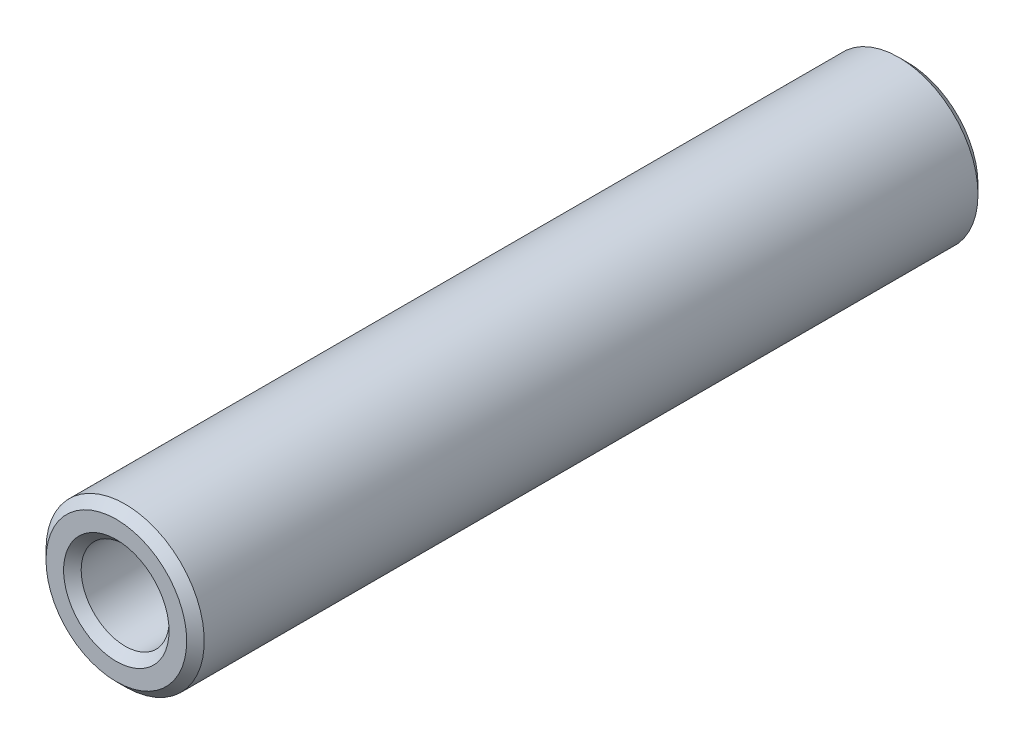
from build123d import *

# Parameters (mm, degrees)
SKETCH1_R           = 4.5
SKETCH1_R_2         = 2.5
BOSS_EXTRUDE1_DEPTH = 22.5
CHAMFER1_SIZE       = 0.5


with BuildPart() as part:
    # Sketch1 → Boss-Extrude1 (new, symmetric)
    with BuildSketch(Plane.XY):
        with Locations(Location((0, 0, 0), (0, 0, 180))):
            Circle(SKETCH1_R)
        with Locations(Location((0, 0, 0), (0, 0, 180))):
            Circle(SKETCH1_R_2, mode=Mode.SUBTRACT)
    extrude(amount=BOSS_EXTRUDE1_DEPTH, both=True)

    # Chamfer1
    chamfer1_edges = [part.edges().sort_by_distance(p)[0] for p in [
        (4.5, 0, -22.5),
        (4.5, 0, 22.5),
        (2.5, 0, -22.5),
        (2.5, 0, 22.5),
    ]]
    chamfer(chamfer1_edges, length=CHAMFER1_SIZE)


solid = part.part
